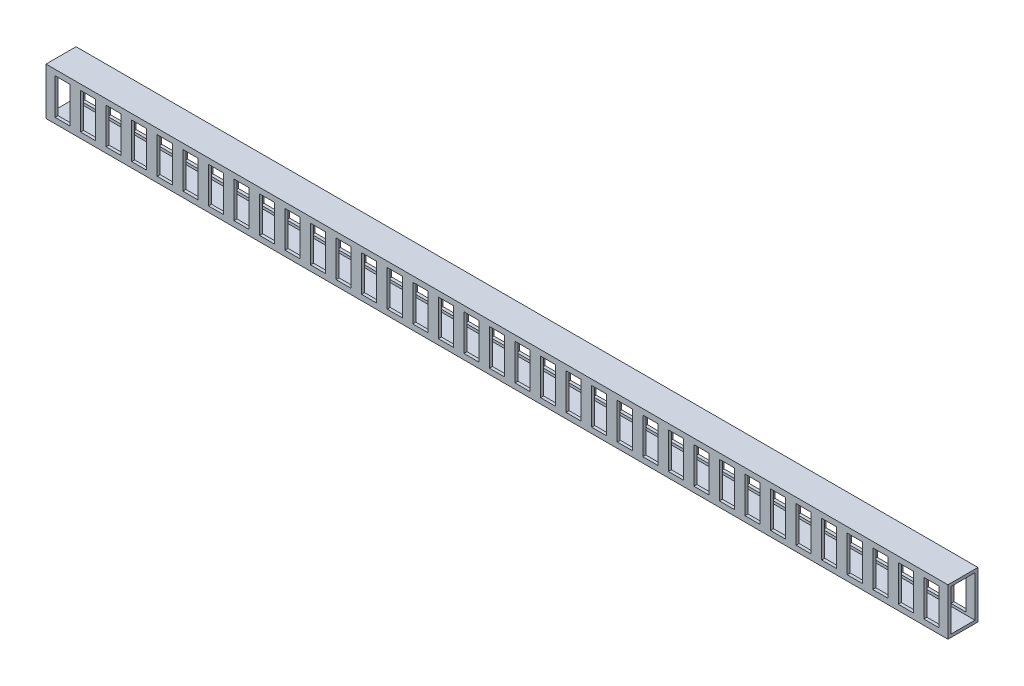
from build123d import *

# Parameters (mm, degrees)
SKETCH2_W           = 25.4
SKETCH2_H           = 39.878
BOSS_EXTRUDE1_DEPTH = 762
SKETCH3_W           = 20.32
SKETCH3_H           = 34.798
CUT_EXTRUDE1_DEPTH  = 764.465398616
SKETCH4_W           = 12.7
SKETCH4_H           = 30.48
CUT_EXTRUDE2_DEPTH  = 764.465398616


with BuildPart() as part:
    # Sketch2 → Boss-Extrude1 (new body)
    with BuildSketch(Plane(origin=(0, 0, 0), x_dir=(0, 0, -1), z_dir=(1, 0, 0))):
        with Locations((12.7, 19.939)):
            Rectangle(SKETCH2_W, SKETCH2_H)
    extrude(amount=BOSS_EXTRUDE1_DEPTH)

    # Sketch3 → Cut-Extrude1 (cut, through all)
    with BuildSketch(Plane(origin=(762, 0, 0), x_dir=(0, 0, -1), z_dir=(1, 0, 0))):
        with Locations((12.7, 19.939)):
            Rectangle(SKETCH3_W, SKETCH3_H)
    extrude(amount=-CUT_EXTRUDE1_DEPTH, mode=Mode.SUBTRACT)

    # Sketch4 → Cut-Extrude2 (cut, through all)
    with BuildSketch(Plane(origin=(0, 0, -25.4), x_dir=(-1, 0, 0), z_dir=(0, 0, -1))):
        with Locations((-748.03, 19.939)):
            Rectangle(SKETCH4_W, SKETCH4_H)
        with Locations((-726.44, 19.939)):
            Rectangle(SKETCH4_W, SKETCH4_H)
        with Locations((-704.85, 19.939)):
            Rectangle(SKETCH4_W, SKETCH4_H)
        with Locations((-683.26, 19.939)):
            Rectangle(SKETCH4_W, SKETCH4_H)
        with Locations((-661.67, 19.939)):
            Rectangle(SKETCH4_W, SKETCH4_H)
        with Locations((-640.08, 19.939)):
            Rectangle(SKETCH4_W, SKETCH4_H)
        with Locations((-618.49, 19.939)):
            Rectangle(SKETCH4_W, SKETCH4_H)
        with Locations((-596.9, 19.939)):
            Rectangle(SKETCH4_W, SKETCH4_H)
        with Locations((-575.31, 19.939)):
            Rectangle(SKETCH4_W, SKETCH4_H)
        with Locations((-553.72, 19.939)):
            Rectangle(SKETCH4_W, SKETCH4_H)
        with Locations((-532.13, 19.939)):
            Rectangle(SKETCH4_W, SKETCH4_H)
        with Locations((-510.54, 19.939)):
            Rectangle(SKETCH4_W, SKETCH4_H)
        with Locations((-488.95, 19.939)):
            Rectangle(SKETCH4_W, SKETCH4_H)
        with Locations((-467.36, 19.939)):
            Rectangle(SKETCH4_W, SKETCH4_H)
        with Locations((-445.77, 19.939)):
            Rectangle(SKETCH4_W, SKETCH4_H)
        with Locations((-424.18, 19.939)):
            Rectangle(SKETCH4_W, SKETCH4_H)
        with Locations((-402.59, 19.939)):
            Rectangle(SKETCH4_W, SKETCH4_H)
        with Locations((-381, 19.939)):
            Rectangle(SKETCH4_W, SKETCH4_H)
        with Locations((-359.41, 19.939)):
            Rectangle(SKETCH4_W, SKETCH4_H)
        with Locations((-337.82, 19.939)):
            Rectangle(SKETCH4_W, SKETCH4_H)
        with Locations((-316.23, 19.939)):
            Rectangle(SKETCH4_W, SKETCH4_H)
        with Locations((-294.64, 19.939)):
            Rectangle(SKETCH4_W, SKETCH4_H)
        with Locations((-273.05, 19.939)):
            Rectangle(SKETCH4_W, SKETCH4_H)
        with Locations((-251.46, 19.939)):
            Rectangle(SKETCH4_W, SKETCH4_H)
        with Locations((-229.87, 19.939)):
            Rectangle(SKETCH4_W, SKETCH4_H)
        with Locations((-208.28, 19.939)):
            Rectangle(SKETCH4_W, SKETCH4_H)
        with Locations((-186.69, 19.939)):
            Rectangle(SKETCH4_W, SKETCH4_H)
        with Locations((-165.1, 19.939)):
            Rectangle(SKETCH4_W, SKETCH4_H)
        with Locations((-143.51, 19.939)):
            Rectangle(SKETCH4_W, SKETCH4_H)
        with Locations((-121.92, 19.939)):
            Rectangle(SKETCH4_W, SKETCH4_H)
        with Locations((-100.33, 19.939)):
            Rectangle(SKETCH4_W, SKETCH4_H)
        with Locations((-78.74, 19.939)):
            Rectangle(SKETCH4_W, SKETCH4_H)
        with Locations((-57.15, 19.939)):
            Rectangle(SKETCH4_W, SKETCH4_H)
        with Locations((-35.56, 19.939)):
            Rectangle(SKETCH4_W, SKETCH4_H)
        with Locations((-13.97, 19.939)):
            Rectangle(SKETCH4_W, SKETCH4_H)
    extrude(amount=-CUT_EXTRUDE2_DEPTH, mode=Mode.SUBTRACT)


solid = part.part
